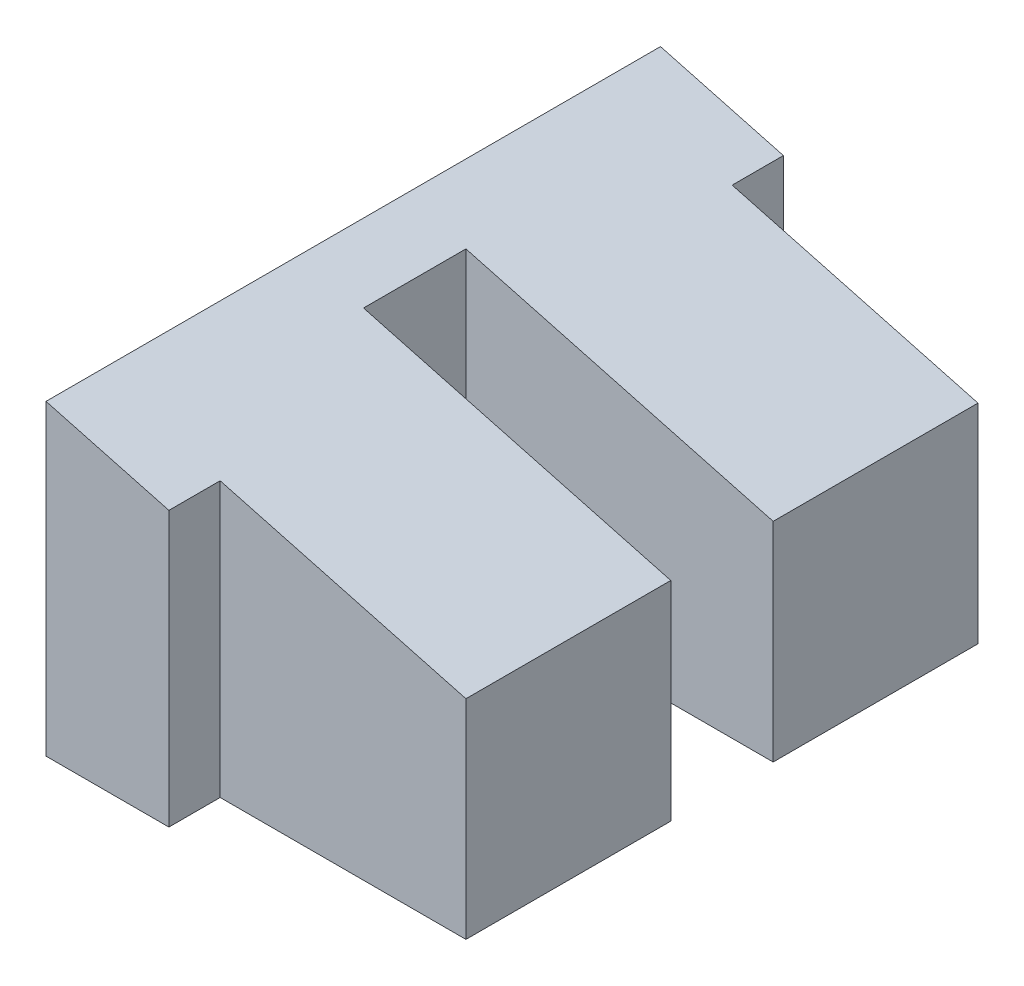
from build123d import *

# Parameters (mm, degrees)
CROQUIS1_W                 = 50
CROQUIS1_H                 = 25
SALIENTE_EXTRUIR1_DEPTH    = 10
CROQUIS2_W                 = 16.666666667
CROQUIS2_H                 = 25
SALIENTE_EXTRUIR2_DEPTH    = 20
CORTAR_EXTRUIR1_DEPTH      = 64.442887702
CORTAR_EXTRUIR1_DEPTH_BACK = 64.442887702
CROQUIS5_W                 = 5
CROQUIS5_H                 = 8.331666666
CORTAR_EXTRUIR3_DEPTH      = 47.368092477


with BuildPart() as part:
    # Croquis1 → Saliente-Extruir1 (new body)
    with BuildSketch(Plane(origin=(0, 0, 0), x_dir=(0, 0, -1), z_dir=(1, 0, 0))):
        with Locations((0, 12.5)):
            Rectangle(CROQUIS1_W, CROQUIS1_H)
    extrude(amount=SALIENTE_EXTRUIR1_DEPTH)

    # Croquis2 → Saliente-Extruir2 (add)
    with BuildSketch(Plane(origin=(10, 0, 0), x_dir=(0, 0, -1), z_dir=(1, 0, 0))):
        with Locations((-12.496666667, 12.5)):
            Rectangle(CROQUIS2_W, CROQUIS2_H)
        with Locations((12.501666667, 12.5)):
            Rectangle(CROQUIS2_W, CROQUIS2_H)
    extrude(amount=SALIENTE_EXTRUIR2_DEPTH)

    # Croquis3 → Cortar-Extruir1 (cut, two sides: drawn at the far end of the back side and taken through both)
    with BuildSketch(Plane.XY.offset(25).offset(-CORTAR_EXTRUIR1_DEPTH_BACK)):
        Polygon((-85.10047698, 47.802604082), (0, 25), (30, 16.961524227), (115.10047698, -5.841079855), (160.705685145, 164.359874105), (-39.495268815, 218.003558043), align=None)
    extrude(amount=CORTAR_EXTRUIR1_DEPTH + CORTAR_EXTRUIR1_DEPTH_BACK, mode=Mode.SUBTRACT)

    # Croquis5 → Cortar-Extruir3 (cut, through all)
    with BuildSketch(Plane.XZ):
        with Locations((7.5, -0.0025)):
            Rectangle(CROQUIS5_W, CROQUIS5_H)
    extrude(amount=-CORTAR_EXTRUIR3_DEPTH, mode=Mode.SUBTRACT)


solid = part.part
